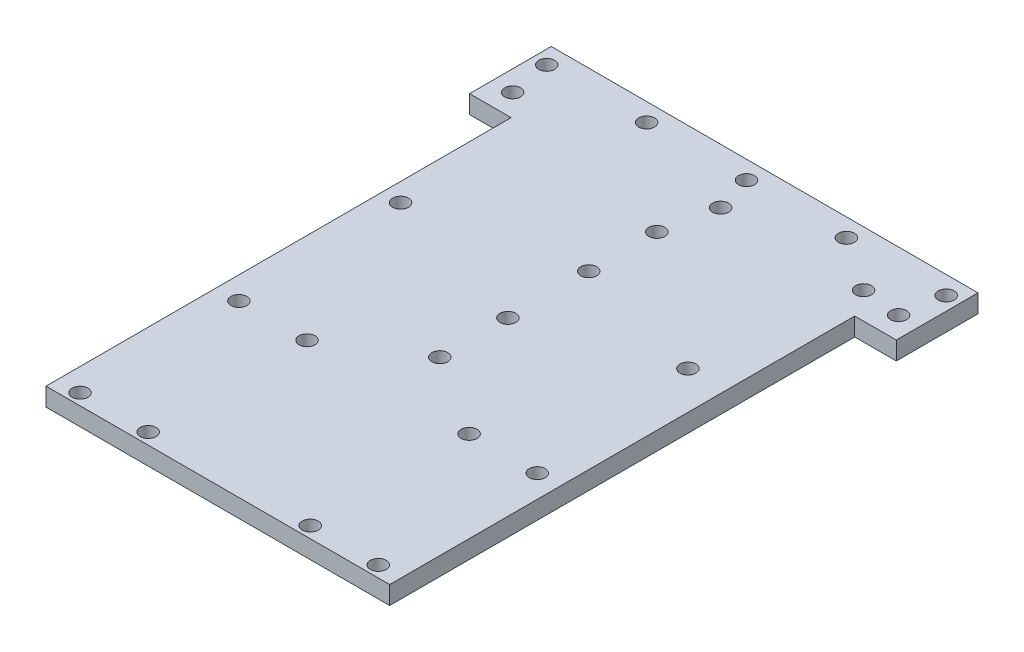
from build123d import *
from build123d.topology import SkipClean

# Parameters (mm, degrees)
SKETCH1_W           = 75.7
SKETCH1_H           = 42.7
SKETCH1_R           = 1.75
BOSS_EXTRUDE1_DEPTH = 4
SKETCH3_W           = 75.7
SKETCH3_H           = 29.75
SKETCH3_R           = 1.75
BOSS_EXTRUDE2_DEPTH = 4
SKETCH3_3_R         = 1.75
CUT_EXTRUDE1_DEPTH  = 4
SKETCH4_W           = 75.7
SKETCH4_H           = 40
SKETCH4_R           = 1.75
BOSS_EXTRUDE3_DEPTH = 4
BOSS_EXTRUDE4_DEPTH = 4
SKETCH6_3_R         = 1.75
CUT_EXTRUDE2_DEPTH  = 103.587572347
SKETCH7_W           = 9.15
SKETCH7_H           = 10
SKETCH7_R           = 1.75
BOSS_EXTRUDE5_DEPTH = 4


with BuildPart() as part:
    # Sketch1 → Boss-Extrude1 (new body)
    with BuildSketch(Plane(origin=(0, 0, 0), x_dir=(1, 0, 0), z_dir=(0, 1, 0))):
        Rectangle(SKETCH1_W, SKETCH1_H)
        with Locations((2.4, 17.25)):
            Circle(SKETCH1_R, mode=Mode.SUBTRACT)
        with Locations((-33.8, -17.05)):
            Circle(SKETCH1_R, mode=Mode.SUBTRACT)
        with Locations((29.5, -17.05)):
            Circle(SKETCH1_R, mode=Mode.SUBTRACT)
        with Locations((33.9, 17.25)):
            Circle(SKETCH1_R, mode=Mode.SUBTRACT)
    extrude(amount=BOSS_EXTRUDE1_DEPTH)

    # Sketch3 → Boss-Extrude2 (add)
    with BuildSketch(Plane(origin=(0, 4, 0), x_dir=(1, 0, 0), z_dir=(0, 1, 0))):
        with Locations((0, -36.225)):
            Rectangle(SKETCH3_W, SKETCH3_H)
        with Locations((0, -42.2)):
            Circle(SKETCH3_R, mode=Mode.SUBTRACT)
        with Locations((0, -27.2)):
            Circle(SKETCH3_R, mode=Mode.SUBTRACT)
    extrude(amount=-BOSS_EXTRUDE2_DEPTH)

    # Sketch3<3> → Cut-Extrude1 (cut)
    with BuildSketch(Plane(origin=(0, 4, 0), x_dir=(1, 0, 0), z_dir=(0, 1, 0))):
        with Locations((0, 5.6)):
            Circle(SKETCH3_3_R)
        with Locations((0, -9.4)):
            Circle(SKETCH3_3_R)
    extrude(amount=-CUT_EXTRUDE1_DEPTH, mode=Mode.SUBTRACT)

    # Sketch4 → Boss-Extrude3 (add)
    # profile 1 of 2: a face of its own
    with BuildSketch(Plane(origin=(0, 0, 0), x_dir=(1, 0, 0), z_dir=(0, 1, 0))):
        with Locations((0, -71.1)):
            Rectangle(SKETCH4_W, SKETCH4_H)
        with Locations((-32.85, -53.6)):
            Circle(SKETCH4_R, mode=Mode.SUBTRACT)
        with Locations((-17.85, -53.6)):
            Circle(SKETCH4_R, mode=Mode.SUBTRACT)
        with Locations((-17.85, -88.6)):
            Circle(SKETCH4_R, mode=Mode.SUBTRACT)
        with Locations((-32.85, -88.6)):
            Circle(SKETCH4_R, mode=Mode.SUBTRACT)
        with Locations((32.85, -88.6)):
            Circle(SKETCH4_R, mode=Mode.SUBTRACT)
        with Locations((17.85, -88.6)):
            Circle(SKETCH4_R, mode=Mode.SUBTRACT)
        with Locations((17.85, -53.6)):
            Circle(SKETCH4_R, mode=Mode.SUBTRACT)
        with Locations((32.85, -53.6)):
            Circle(SKETCH4_R, mode=Mode.SUBTRACT)
    # profile 2 of 2: a face of its own
    with BuildSketch(Plane(origin=(0, 0, 0), x_dir=(1, 0, 0), z_dir=(0, 1, 0))):
        Polygon((-37.85, 21.35), (-44, 21.35), (-44, 29.35), (44, 29.35), (44, 21.35), (37.85, 21.35), align=None)
    extrude(amount=BOSS_EXTRUDE3_DEPTH)

    # Sketch6 → Boss-Extrude4 (add)
    with BuildSketch(Plane(origin=(0, 4, 0), x_dir=(1, 0, 0), z_dir=(0, 1, 0))):
        with BuildLine():
            Line((-44, 27.1), (-44, 29.35))
            Line((-44, 29.35), (-47, 29.35))
            Line((-47, 29.35), (-47, 21.35))
            Line((-47, 21.35), (-44, 21.35))
            Line((-44, 21.35), (-44, 23.6))
            ThreePointArc((-44, 23.6), (-45.75, 25.35), (-44, 27.1))
        make_face()
        with BuildLine():
            Line((47, 29.35), (44, 29.35))
            Line((44, 29.35), (44, 27.1))
            ThreePointArc((44, 27.1), (45.75, 25.35), (44, 23.6))
            Line((44, 23.6), (44, 21.35))
            Line((44, 21.35), (47, 21.35))
            Line((47, 21.35), (47, 29.35))
        make_face()
    extrude(amount=-BOSS_EXTRUDE4_DEPTH)

    # Sketch6<3> → Cut-Extrude2 (cut, through all)
    with SkipClean():  # the faces are left unmerged after this step: merging them gives an invalid solid
        with BuildSketch(Plane(origin=(0, 4, 0), x_dir=(1, 0, 0), z_dir=(0, 1, 0))):
            with Locations((0, 25.35)):
                Circle(SKETCH6_3_R)
            with Locations((22, 25.35)):
                Circle(SKETCH6_3_R)
            with Locations((44, 25.35)):
                Circle(SKETCH6_3_R)
            with Locations((-22, 25.35)):
                Circle(SKETCH6_3_R)
            with Locations((-44, 25.35)):
                Circle(SKETCH6_3_R)
        extrude(amount=-CUT_EXTRUDE2_DEPTH, mode=Mode.SUBTRACT)

    # Sketch7 → Boss-Extrude5 (add)
    # profile 1 of 2: a face of its own
    with SkipClean():  # the faces are left unmerged after this step: merging them gives an invalid solid
        with BuildSketch(Plane(origin=(0, 0, 0), x_dir=(1, 0, 0), z_dir=(0, 1, 0))):
            with Locations((-42.425, 16.35)):
                Rectangle(SKETCH7_W, SKETCH7_H)
            with Locations((-42.5, 16.35)):
                Circle(SKETCH7_R, mode=Mode.SUBTRACT)
        # profile 2 of 2: a face of its own
        with BuildSketch(Plane(origin=(0, 0, 0), x_dir=(1, 0, 0), z_dir=(0, 1, 0))):
            with Locations((42.425, 16.35)):
                Rectangle(SKETCH7_W, SKETCH7_H)
            with Locations((42.5, 16.35)):
                Circle(SKETCH7_R, mode=Mode.SUBTRACT)
        extrude(amount=BOSS_EXTRUDE5_DEPTH)


solid = part.part
